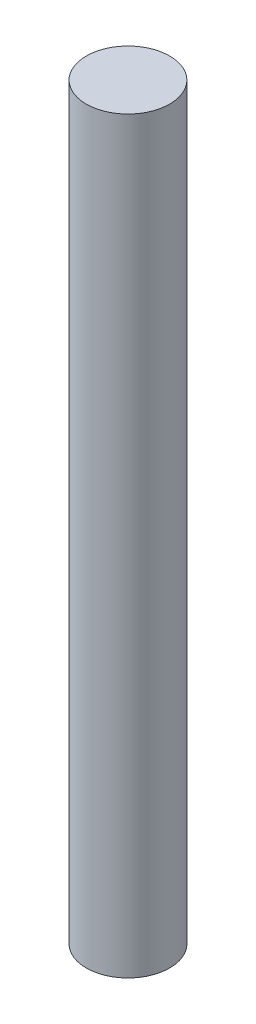
from build123d import *

# Parameters (mm, degrees)
SKETCH2_R           = 3.9
BOSS_EXTRUDE1_DEPTH = 70


with BuildPart() as part:
    # Sketch2 → Boss-Extrude1 (new body)
    with BuildSketch(Plane(origin=(0, 0, 0), x_dir=(1, 0, 0), z_dir=(0, 1, 0))):
        with Locations(Location((0, 0, 0), (0, 0, 270))):
            Circle(SKETCH2_R)
    extrude(amount=BOSS_EXTRUDE1_DEPTH)


solid = part.part
